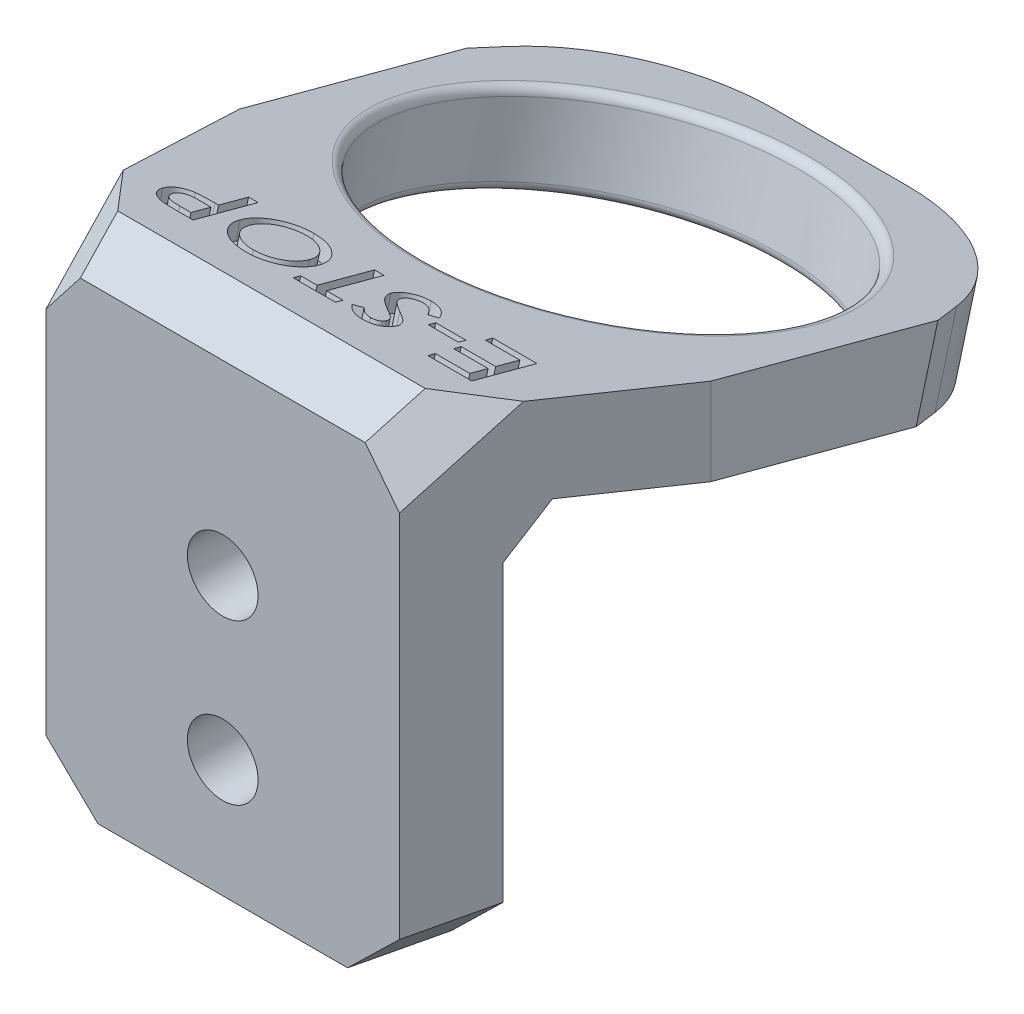
from build123d import *
from OCP.BRepFilletAPI import BRepFilletAPI_MakeChamfer

# Parameters (mm, degrees)
BOSS_EXTRUDE1_DEPTH   = 28
CUT_EXTRUDE1_DEPTH    = 50
SKETCH3_R             = 11.5
CUT_EXTRUDE2_DEPTH    = 5
CHAMFER1_SIZE         = 3
SKETCH4_R             = 2.1
CUT_EXTRUDE3_DEPTH    = 5
CHAMFER2_SIZE         = 3
CHAMFER2_SIZE2        = 2.449489743
FILLET1_R             = 0.5
CHAMFER3_SIZE         = 1
FILLET2_R             = 10
CHAMFER4_SIZE         = 2
CHAMFER4_SIZE2        = 2.272959563
CHAMFER4_EDGE_2_SIZE  = 2
CHAMFER4_EDGE_2_SIZE2 = 2.272959563
SKETCH5_W             = 1.794871795
SKETCH5_H             = 0.461538462
CUT_EXTRUDE4_DEPTH    = 1


with BuildPart() as part:
    # Sketch1 → Boss-Extrude1 (new body)
    with BuildSketch(Plane(origin=(0, 0, 0), x_dir=(0, 0, -1), z_dir=(1, 0, 0))):
        Polygon((0, 0), (0, -30), (5, -30), (5, -6.516126864), (35.411086173, -14.664752845), (36.705181399, -9.835123714), align=None)
    extrude(amount=BOSS_EXTRUDE1_DEPTH)

    # Sketch2 → Cut-Extrude1 (cut)
    with BuildSketch(Plane(origin=(0, 0, 0), x_dir=(1, 0, 0), z_dir=(0, 1, 0))):
        Polygon((3.5, 0), (0, 15), (0, 0), align=None)
        Polygon((28, 0), (24.5, 0), (28, 15), align=None)
    extrude(amount=-CUT_EXTRUDE1_DEPTH, mode=Mode.SUBTRACT)

    # Sketch3 → Cut-Extrude2 (cut)
    with BuildSketch(Plane(origin=(0, 0, 0), x_dir=(1, 0, 0), z_dir=(0, 0.9659258262890673, -0.2588190451025246))):
        with Locations(Location((14, 24, 0), (0, 0, 270))):
            Circle(SKETCH3_R)
        Polygon((3, 38), (0, 29.5), (0, 38), align=None)
        Polygon((28, 38), (25, 38), (28, 29.5), align=None)
    extrude(amount=-CUT_EXTRUDE2_DEPTH, mode=Mode.SUBTRACT)

    # Chamfer1
    chamfer1_edges = [part.edges().sort_by_distance(p)[0] for p in [
        (2.916666667, -30, -2.5),
        (25.083333333, -30, -2.5),
    ]]
    chamfer(chamfer1_edges, length=CHAMFER1_SIZE)

    # Sketch4 → Cut-Extrude3 (cut)
    with BuildSketch(Plane(origin=(0, 0, -5), x_dir=(-1, 0, 0), z_dir=(0, 0, -1))):
        with Locations((-14, -13.516126864)):
            Circle(SKETCH4_R)
        with Locations((-14, -23)):
            Circle(SKETCH4_R)
    extrude(amount=-CUT_EXTRUDE3_DEPTH, mode=Mode.SUBTRACT)

    # Chamfer2: one chamfer whose edges measure the first distance from different faces: ONE call of the kernel's chamfer builder (chamfer() names one face for all edges)
    chamfer2_edges_1 = [part.edges().sort_by_distance(p)[0] for p in [
        (14, -6.516126864, -5),
    ]]
    chamfer2_side_1 = [part.faces().sort_by_distance(p)[0] for p in [
        (14, -18.063791271, -5),
    ]]
    chamfer2_edges_2 = [part.edges().sort_by_distance(p)[0] for p in [
        (14, 0, 0),
    ]]
    chamfer2_side_2 = [part.faces().sort_by_distance(p)[0] for p in [
        (0.472016949, -5.827199858, -21.747405938),
    ]]
    chamfer2 = BRepFilletAPI_MakeChamfer(part.part.solid().wrapped)
    for e in chamfer2_edges_1:
        chamfer2.Add(CHAMFER2_SIZE, CHAMFER2_SIZE2, e.wrapped, chamfer2_side_1[0].wrapped)  # the first distance lies on this face
    for e in chamfer2_edges_2:
        chamfer2.Add(CHAMFER2_SIZE, CHAMFER2_SIZE2, e.wrapped, chamfer2_side_2[0].wrapped)  # the first distance lies on this face
    add(Compound.cast(chamfer2.Shape()), mode=Mode.REPLACE)

    # Fillet1
    fillet1_edges = [part.edges().sort_by_distance(p)[0] for p in [
        (14, -9.188076101, -34.290366833),
        (14, -14.017705233, -32.996271608),
    ]]
    fillet(fillet1_edges, radius=FILLET1_R)

    # Chamfer3
    chamfer3_edges = [part.edges().sort_by_distance(p)[0] for p in [
        (16.1, -13.516126864, -5),
        (16.1, -23, -5),
    ]]
    chamfer(chamfer3_edges, length=CHAMFER3_SIZE)

    # Fillet2
    fillet2_edges = [part.edges().sort_by_distance(p)[0] for p in [
        (3, -12.24993828, -36.058133786),
        (25, -12.24993828, -36.058133786),
    ]]
    fillet(fillet2_edges, radius=FILLET2_R)

    # Chamfer4
    chamfer4_edges = [part.edges().sort_by_distance(p)[0] for p in [
        (3.161925961, -1.612973439, -1.448888739),
    ]]
    chamfer4_side = [part.faces().sort_by_distance(p)[0] for p in [
        (14, -1.60427557, -1.463953891),
    ]]
    chamfer(chamfer4_edges, length=CHAMFER4_SIZE, length2=CHAMFER4_SIZE2, reference=chamfer4_side[0])

    # Chamfer4 edge 2
    chamfer4_edge_2_edges = [part.edges().sort_by_distance(p)[0] for p in [
        (24.838074039, -1.612973439, -1.448888739),
    ]]
    chamfer4_edge_2_side = [part.faces().sort_by_distance(p)[0] for p in [
        (14, -1.60427557, -1.463953891),
    ]]
    chamfer(chamfer4_edge_2_edges, length=CHAMFER4_EDGE_2_SIZE, length2=CHAMFER4_EDGE_2_SIZE2, reference=chamfer4_edge_2_side[0])

    # Sketch5 → Cut-Extrude4 (cut)
    # profile 1 of 6: a face of its own
    with BuildSketch(Plane(origin=(0, 0, 0), x_dir=(1, 0, 0), z_dir=(0, 0.9659258262890674, -0.25881904510252457))):
        Polygon((23.487179487, 5.5), (20.871794872, 5.5), (20.871794872, 5.961538462), (22.923076923, 5.961538462), (22.923076923, 7.08974359), (20.871794872, 7.08974359), (20.871794872, 7.551282051), (22.923076923, 7.551282051), (22.923076923, 9.038461538), (20.871794872, 9.038461538), (20.871794872, 9.5), (23.487179487, 9.5), align=None)
    # profile 2 of 6: a face of its own
    with BuildSketch(Plane(origin=(0, 0, 0), x_dir=(1, 0, 0), z_dir=(0, 0.9659258262890674, -0.25881904510252457))):
        with Locations((19.615384616, 7.987179487)):
            Rectangle(SKETCH5_W, SKETCH5_H)
    # profile 3 of 6: a face of its own
    with BuildSketch(Plane(origin=(0, 0, 0), x_dir=(1, 0, 0), z_dir=(0, 0.9659258262890674, -0.25881904510252457))):
        with BuildLine():
            Line((18.461538462, 8.705128205), (17.993589744, 8.474358974))
            add(Edge.make_bspline(
                [(17.993589744, 8.474358974), (17.959354756, 8.52696343), (17.893868775, 8.627587223), (17.787932117, 8.76387961), (17.680605445, 8.878915314), (17.572992906, 8.974378923), (17.463450752, 9.048388252), (17.352420295, 9.101600358), (17.239875611, 9.134741775), (17.163935855, 9.138954562), (17.126602564, 9.141025641)],
                knots=[0, 0, 0, 0, 1.321178742, 2.527200697, 3.629351455, 4.629811315, 5.550108467, 6.402922587, 7.214849271, 8, 8, 8, 8], degree=3))
            add(Edge.make_bspline(
                [(17.126602564, 9.141025641), (17.091801992, 9.140010464), (17.023119482, 9.138006908), (16.922203286, 9.120154133), (16.824274645, 9.093430583), (16.731660091, 9.053909615), (16.645598771, 9.006995366), (16.569840622, 8.950914233), (16.505046678, 8.887441807), (16.452615579, 8.816624426), (16.410099229, 8.742354056), (16.381922381, 8.66436365), (16.361643601, 8.585164993), (16.359865807, 8.531110984), (16.358974359, 8.50400641)],
                knots=[0, 0, 0, 0, 1.130239897, 2.230644695, 3.321798329, 4.423024733, 5.495612335, 6.500952383, 7.477041138, 8.432014547, 9.35704049, 10.247145551, 11.121057374, 12, 12, 12, 12], degree=3))
            add(Edge.make_bspline(
                [(16.358974359, 8.50400641), (16.360715559, 8.473102434), (16.364259999, 8.410193349), (16.392598463, 8.317022668), (16.436928998, 8.224337193), (16.478442062, 8.167392284), (16.5, 8.137820513)],
                knots=[0, 0, 0, 0, 0.927015872, 1.887062035, 2.90274091, 4, 4, 4, 4], degree=3))
            add(Edge.make_bspline(
                [(16.5, 8.137820513), (16.518430721, 8.115947052), (16.557557853, 8.069511223), (16.625290903, 8.001009514), (16.703598629, 7.929346722), (16.792829423, 7.854583029), (16.891544081, 7.775137952), (17.002527287, 7.693922238), (17.123679244, 7.608899909), (17.208494801, 7.551929499), (17.252403846, 7.522435897)],
                knots=[0, 0, 0, 0, 0.703636345, 1.493770772, 2.368296737, 3.315047346, 4.357938535, 5.485823767, 6.698410034, 8, 8, 8, 8], degree=3))
            add(Edge.make_bspline(
                [(17.252403846, 7.522435897), (17.297416598, 7.492729634), (17.383430985, 7.435964251), (17.503989818, 7.351690617), (17.612087399, 7.274482948), (17.707163875, 7.204055018), (17.788443784, 7.138493744), (17.857355665, 7.080582506), (17.913431238, 7.029034051), (17.943872685, 6.994612116), (17.957532051, 6.979166667)],
                knots=[0, 0, 0, 0, 1.450649473, 2.772030612, 3.956335671, 5.023968659, 5.954145879, 6.76460605, 7.445667014, 8, 8, 8, 8], degree=3))
            add(Edge.make_bspline(
                [(17.957532051, 6.979166667), (17.97708561, 6.955113536), (18.015428469, 6.907947402), (18.066598691, 6.833927926), (18.108632835, 6.7576007), (18.144757132, 6.680298199), (18.17175, 6.600974122), (18.191251676, 6.520269957), (18.202634426, 6.438092684), (18.204293837, 6.382779818), (18.205128205, 6.354967949)],
                knots=[0, 0, 0, 0, 1.083814774, 2.125268204, 3.141324264, 4.127667949, 5.105350172, 6.065883877, 7.027506829, 8, 8, 8, 8], degree=3))
            add(Edge.make_bspline(
                [(18.205128205, 6.354967949), (18.20357193, 6.311012212), (18.20050394, 6.22435932), (18.171960765, 6.098032581), (18.126799571, 5.977792319), (18.063367831, 5.864994024), (17.983529298, 5.761668723), (17.889835495, 5.667784932), (17.779487826, 5.588216305), (17.657654276, 5.519409371), (17.52558173, 5.465434983), (17.387012586, 5.425828189), (17.242533841, 5.402105305), (17.144318282, 5.399006234), (17.094551282, 5.397435897)],
                knots=[0, 0, 0, 0, 0.967311025, 1.906925137, 2.83817182, 3.78932571, 4.746287785, 5.707564954, 6.701000116, 7.73389989, 8.784156629, 9.836653355, 10.903806353, 12, 12, 12, 12], degree=3))
            add(Edge.make_bspline(
                [(17.094551282, 5.397435897), (17.038913536, 5.399243249), (16.928950697, 5.402815312), (16.766702004, 5.42785531), (16.610743709, 5.471182062), (16.48422873, 5.519137656), (16.386341921, 5.569651926), (16.311272228, 5.613696363), (16.236115505, 5.666122249), (16.160178859, 5.725879938), (16.081941008, 5.791374057), (16.003819161, 5.865438254), (15.924288269, 5.946294836), (15.872627971, 6.004054174), (15.846153846, 6.033653846)],
                knots=[0, 0, 0, 0, 1.380091053, 2.727621867, 4.060131507, 5.390217395, 6.074729597, 6.790622051, 7.547849161, 8.345727943, 9.187308138, 10.077929239, 11.015004885, 12, 12, 12, 12], degree=3))
            Line((15.846153846, 6.033653846), (16.297275641, 6.320512821))
            add(Edge.make_bspline(
                [(16.297275641, 6.320512821), (16.32034359, 6.297102195), (16.36476631, 6.252019571), (16.431830235, 6.189521382), (16.494713898, 6.132695561), (16.554042689, 6.082211698), (16.608974618, 6.037853719), (16.660857185, 6.000802223), (16.708642028, 5.969196317), (16.767995607, 5.936252668), (16.842256992, 5.905482299), (16.933320186, 5.87884968), (17.027714409, 5.86228568), (17.091814155, 5.86008579), (17.124198718, 5.858974359)],
                knots=[0, 0, 0, 0, 1.211298283, 2.332637626, 3.378344346, 4.335137, 5.203845459, 5.979793381, 6.684314862, 7.314473412, 8.479227738, 9.638184222, 10.80676015, 12, 12, 12, 12], degree=3))
            add(Edge.make_bspline(
                [(17.124198718, 5.858974359), (17.159862255, 5.860446073), (17.228796511, 5.863290757), (17.327282737, 5.887100741), (17.416664244, 5.925926377), (17.494857189, 5.980505785), (17.560977392, 6.047187323), (17.607354295, 6.127593112), (17.636881292, 6.217523196), (17.639617128, 6.281278757), (17.641025641, 6.314102564)],
                knots=[0, 0, 0, 0, 1.107639684, 2.140963101, 3.130056742, 4.120648403, 5.089736944, 6.024077683, 6.982719454, 8, 8, 8, 8], degree=3))
            add(Edge.make_bspline(
                [(17.641025641, 6.314102564), (17.640564499, 6.335528758), (17.63964713, 6.378152843), (17.627534178, 6.440645963), (17.61016699, 6.501924201), (17.583823128, 6.561273481), (17.550847992, 6.620882281), (17.507847056, 6.678837479), (17.456827388, 6.737441513), (17.417816605, 6.774111463), (17.397435897, 6.793269231)],
                knots=[0, 0, 0, 0, 0.925478106, 1.841094992, 2.74416004, 3.67567675, 4.643047564, 5.685347748, 6.790738184, 8, 8, 8, 8], degree=3))
            add(Edge.make_bspline(
                [(17.397435897, 6.793269231), (17.387074909, 6.801886044), (17.363240018, 6.821708556), (17.321012653, 6.853678277), (17.268368653, 6.893010769), (17.203896235, 6.938450386), (17.128828262, 6.991430154), (17.042225429, 7.050645725), (16.944355882, 7.116054071), (16.875780872, 7.162362753), (16.83974359, 7.186698718)],
                knots=[0, 0, 0, 0, 0.473655243, 1.089618189, 1.861401557, 2.783674801, 3.862059649, 5.091263366, 6.471411624, 8, 8, 8, 8], degree=3))
            add(Edge.make_bspline(
                [(16.83974359, 7.186698718), (16.791188213, 7.21897699), (16.697198395, 7.281458822), (16.564429991, 7.377013033), (16.442944391, 7.468911935), (16.333977543, 7.558580773), (16.236787722, 7.645303683), (16.150799682, 7.728048413), (16.077185507, 7.808401661), (16.015629777, 7.886855009), (15.963786586, 7.964109463), (15.919058991, 8.040199678), (15.879783129, 8.115384407), (15.849553666, 8.191325418), (15.825268975, 8.266798178), (15.807552379, 8.342034208), (15.796566903, 8.417141029), (15.79543518, 8.467111349), (15.794871795, 8.491987179)],
                knots=[0, 0, 0, 0, 1.607706065, 3.112075563, 4.510071815, 5.807725608, 7.00231083, 8.10134029, 9.097199534, 10.004822304, 10.848509488, 11.660746226, 12.438139144, 13.184922348, 13.911677748, 14.622737244, 15.31438191, 16, 16, 16, 16], degree=3))
            add(Edge.make_bspline(
                [(15.794871795, 8.491987179), (15.795786936, 8.527863744), (15.797602463, 8.599038343), (15.817143578, 8.703808407), (15.847012033, 8.805510179), (15.887491056, 8.904763278), (15.942507977, 8.999575654), (16.007407413, 9.092271012), (16.085019308, 9.181363985), (16.173335612, 9.266217583), (16.270023865, 9.344972145), (16.373607543, 9.414408895), (16.483728852, 9.472202398), (16.598852299, 9.520534565), (16.720017214, 9.557297755), (16.846502, 9.584034685), (16.978807172, 9.598990116), (17.068874776, 9.601360933), (17.114583333, 9.602564103)],
                knots=[0, 0, 0, 0, 0.900344094, 1.786169624, 2.667306864, 3.560748783, 4.471236799, 5.415060676, 6.39976209, 7.434252688, 8.488466066, 9.528750474, 10.561280777, 11.608015319, 12.660754287, 13.737217903, 14.851656958, 16, 16, 16, 16], degree=3))
            add(Edge.make_bspline(
                [(17.114583333, 9.602564103), (17.14798195, 9.60185639), (17.214093105, 9.600455503), (17.312221725, 9.592065769), (17.407479676, 9.575137831), (17.501054124, 9.555257471), (17.591689817, 9.526294849), (17.680650483, 9.493275696), (17.766780783, 9.452794599), (17.850550778, 9.405931587), (17.933489937, 9.352316765), (18.01312814, 9.287238185), (18.092885177, 9.21470914), (18.169923696, 9.131099039), (18.245757103, 9.038605419), (18.319425657, 8.935936294), (18.392680508, 8.824761981), (18.43817986, 8.745711427), (18.461538462, 8.705128205)],
                knots=[0, 0, 0, 0, 0.937330318, 1.855405837, 2.75979637, 3.650764605, 4.537371984, 5.426857402, 6.312038117, 7.204518178, 8.119160939, 9.078964442, 10.086785988, 11.142064281, 12.265810438, 13.441157596, 14.686333427, 16, 16, 16, 16], degree=3))
        make_face()
    # profile 4 of 6: a face of its own
    with BuildSketch(Plane(origin=(0, 0, 0), x_dir=(1, 0, 0), z_dir=(0, 0.9659258262890674, -0.25881904510252457))):
        Polygon((15.384615385, 5.961538462), (15.384615385, 5.5), (12.871794872, 5.5), (12.871794872, 5.961538462), (13.846153846, 5.961538462), (13.846153846, 9.5), (14.41025641, 9.5), (14.41025641, 5.961538462), align=None)
    # profile 5 of 6: a face of its own
    with BuildSketch(Plane(origin=(0, 0, 0), x_dir=(1, 0, 0), z_dir=(0, 0.9659258262890674, -0.25881904510252457))):
        with BuildLine():
            add(Edge.make_bspline(
                [(10.181891026, 5.397435897), (10.098203367, 5.399206638), (9.933787741, 5.402685496), (9.692526077, 5.432344831), (9.462031427, 5.479783687), (9.242364761, 5.547664575), (9.033638012, 5.634292895), (8.834980073, 5.739717607), (8.647744201, 5.8652996), (8.473608646, 6.008917482), (8.315028396, 6.165287102), (8.176238166, 6.331962219), (8.058423974, 6.506632385), (7.961456343, 6.68934114), (7.886498837, 6.880245915), (7.833674898, 7.079178513), (7.800424558, 7.286005208), (7.796739536, 7.426956655), (7.794871795, 7.498397436)],
                knots=[0, 0, 0, 0, 1.133465526, 2.226844992, 3.287846438, 4.317982888, 5.336769034, 6.345304697, 7.359975976, 8.385787809, 9.399070829, 10.372968382, 11.319399393, 12.24854394, 13.169826503, 14.091492747, 15.032679333, 16, 16, 16, 16], degree=3))
            add(Edge.make_bspline(
                [(7.794871795, 7.498397436), (7.796743589, 7.569306339), (7.800443349, 7.709463791), (7.833808382, 7.915446069), (7.886371437, 8.114208182), (7.961811287, 8.304587245), (8.056497581, 8.488200304), (8.174709215, 8.662417303), (8.313621281, 8.828894247), (8.471073884, 8.986337384), (8.64428189, 9.130219111), (8.829312012, 9.256748003), (9.0243326, 9.363955493), (9.229509189, 9.451931028), (9.445145523, 9.518603086), (9.66989512, 9.568040011), (9.904944485, 9.597220212), (10.065089431, 9.600761097), (10.146634615, 9.602564103)],
                knots=[0, 0, 0, 0, 0.968886053, 1.915085334, 2.845193648, 3.774914766, 4.709178866, 5.66427878, 6.647096819, 7.669648038, 8.704366239, 9.721300744, 10.729701935, 11.742411692, 12.768036067, 13.810950831, 14.885344663, 16, 16, 16, 16], degree=3))
            add(Edge.make_bspline(
                [(10.146634615, 9.602564103), (10.226304707, 9.600683989), (10.382944749, 9.596987483), (10.613209289, 9.56880663), (10.833716895, 9.520220562), (11.045243929, 9.454279452), (11.246616684, 9.36744692), (11.439379979, 9.263376563), (11.621496418, 9.138152241), (11.792592513, 8.996556484), (11.948612269, 8.841670233), (12.08582957, 8.676871054), (12.201978044, 8.503747418), (12.297483014, 8.322668274), (12.370591171, 8.132606545), (12.423666176, 7.9350513), (12.455771388, 7.728880954), (12.459595795, 7.588789721), (12.461538462, 7.517628205)],
                knots=[0, 0, 0, 0, 1.102743233, 2.168112804, 3.205229065, 4.224943949, 5.230421689, 6.2363888, 7.252719487, 8.284768024, 9.307047138, 10.291751769, 11.248543191, 12.187944297, 13.119724947, 14.061473478, 15.01529537, 16, 16, 16, 16], degree=3))
            add(Edge.make_bspline(
                [(12.461538462, 7.517628205), (12.460628363, 7.469782882), (12.458824311, 7.374941015), (12.443955834, 7.234081161), (12.419665418, 7.096065117), (12.387340398, 6.960277882), (12.343553852, 6.827615479), (12.290324005, 6.697748669), (12.22897946, 6.569786734), (12.156658693, 6.446276412), (12.076793742, 6.327278786), (11.99013519, 6.213800288), (11.896402568, 6.107266779), (11.79541032, 6.007233754), (11.687871831, 5.913615336), (11.572122858, 5.827757545), (11.450743456, 5.747418233), (11.322443994, 5.675054643), (11.190204954, 5.608983683), (11.05349211, 5.553419367), (10.914853232, 5.504917695), (10.773271521, 5.465577805), (10.629011943, 5.435063682), (10.482045523, 5.413889449), (10.332827607, 5.399261544), (10.23240725, 5.398046914), (10.181891026, 5.397435897)],
                knots=[0, 0, 0, 0, 0.994755869, 1.971864723, 2.941605403, 3.907489226, 4.871758807, 5.843342801, 6.824563096, 7.820062962, 8.81673969, 9.80321201, 10.787069662, 11.764999032, 12.757224245, 13.749200702, 14.759755514, 15.782101152, 16.810449002, 17.831571837, 18.848592879, 19.863306026, 20.885093281, 21.912510758, 22.949893459, 24, 24, 24, 24], degree=3))
        make_face()
        with BuildLine():
            add(Edge.make_bspline(
                [(10.162660256, 5.858974359), (10.199812877, 5.859509448), (10.273732815, 5.860574078), (10.383946939, 5.871651513), (10.49283906, 5.888336757), (10.600556946, 5.911382287), (10.706610453, 5.94229624), (10.811534937, 5.979039899), (10.915456955, 6.022445621), (11.017190996, 6.072857388), (11.116424398, 6.128228079), (11.209809267, 6.190347992), (11.299119574, 6.256054839), (11.381690767, 6.328329754), (11.460269362, 6.404459628), (11.532171883, 6.486704447), (11.599654432, 6.573149949), (11.661637717, 6.664488701), (11.716140719, 6.76054074), (11.766084711, 6.858803674), (11.805413161, 6.961520225), (11.83988363, 7.06634628), (11.864654876, 7.17486598), (11.884880707, 7.285674001), (11.894668933, 7.399930871), (11.896506168, 7.477016584), (11.897435897, 7.516025641)],
                knots=[0, 0, 0, 0, 1.001990644, 1.993589858, 2.985162891, 3.973063808, 4.962828715, 5.963263633, 6.970938057, 7.998914906, 9.024945377, 10.03419009, 11.022800262, 12.013823346, 12.992138789, 13.972309967, 14.958185389, 15.949444203, 16.946864503, 17.936157182, 18.91963346, 19.910892273, 20.910600357, 21.919896513, 22.947368164, 24, 24, 24, 24], degree=3))
            add(Edge.make_bspline(
                [(11.897435897, 7.516025641), (11.895967007, 7.573272829), (11.89308435, 7.685618917), (11.868283048, 7.850236488), (11.828390794, 8.007446957), (11.771857625, 8.157346891), (11.699697019, 8.300200145), (11.609609296, 8.434339715), (11.504896236, 8.561760292), (11.385373113, 8.680038398), (11.254614512, 8.78726847), (11.116997394, 8.882474553), (10.972454291, 8.96177695), (10.822795537, 9.028629403), (10.665966921, 9.078677859), (10.503459285, 9.114731993), (10.335021695, 9.137049235), (10.220688488, 9.13968692), (10.162660256, 9.141025641)],
                knots=[0, 0, 0, 0, 1.037379764, 2.035830297, 3.010622093, 3.972958488, 4.934478295, 5.905474182, 6.896239315, 7.920024812, 8.948608687, 9.958640176, 10.949144946, 11.933451802, 12.925754051, 13.927873108, 14.948320782, 16, 16, 16, 16], degree=3))
            add(Edge.make_bspline(
                [(10.162660256, 9.141025641), (10.121769456, 9.14049908), (10.040653107, 9.139454526), (9.920310996, 9.128374277), (9.802213195, 9.112027042), (9.686488424, 9.087511555), (9.572960486, 9.057381396), (9.461624869, 9.020224629), (9.352798891, 8.976437384), (9.247359068, 8.925007042), (9.146132842, 8.868294461), (9.04936126, 8.807457366), (8.958534752, 8.741134891), (8.874719538, 8.668214585), (8.794577408, 8.592607703), (8.7218669, 8.510296545), (8.65430891, 8.42365999), (8.592749828, 8.332369938), (8.537366086, 8.237567474), (8.490399714, 8.139126412), (8.448740301, 8.038939787), (8.416428656, 7.935515952), (8.390445581, 7.829852861), (8.371863723, 7.721439831), (8.36170546, 7.610237634), (8.359887925, 7.535275244), (8.358974359, 7.497596154)],
                knots=[0, 0, 0, 0, 1.081858578, 2.146116458, 3.195743449, 4.235470108, 5.274523773, 6.302749639, 7.339709431, 8.37664513, 9.405113932, 10.409147488, 11.400208425, 12.377741397, 13.347602899, 14.313825616, 15.280952855, 16.253361111, 17.22569229, 18.183605493, 19.137886711, 20.094677823, 21.047885093, 22.015890201, 23.002707179, 24, 24, 24, 24], degree=3))
            add(Edge.make_bspline(
                [(8.358974359, 7.497596154), (8.35988429, 7.460184421), (8.361688083, 7.386021614), (8.371823563, 7.276138445), (8.390680129, 7.168857281), (8.416160053, 7.064137772), (8.448748901, 6.961832039), (8.490611863, 6.863094527), (8.537152885, 6.765766997), (8.59279678, 6.672427844), (8.654522855, 6.582408712), (8.72263107, 6.496816721), (8.796487626, 6.415677751), (8.876337645, 6.339209087), (8.96205026, 6.26693645), (9.054367276, 6.199804523), (9.152319079, 6.137226009), (9.255548193, 6.079592753), (9.362648008, 6.028107959), (9.472346722, 5.982909207), (9.583345826, 5.944548065), (9.696196403, 5.912883117), (9.810615209, 5.889299209), (9.926620968, 5.871292899), (10.044136339, 5.860679246), (10.123109512, 5.85954327), (10.162660256, 5.858974359)],
                knots=[0, 0, 0, 0, 0.993994102, 1.970435157, 2.928134796, 3.884966656, 4.831881522, 5.77666729, 6.731840291, 7.695618628, 8.659997506, 9.62960877, 10.598986353, 11.572535772, 12.564603331, 13.575073874, 14.602516262, 15.650745094, 16.713876989, 17.757460749, 18.800875647, 19.832059759, 20.868794719, 21.902392729, 22.949492276, 24, 24, 24, 24], degree=3))
        make_face(mode=Mode.SUBTRACT)
    # profile 6 of 6: a face of its own
    with BuildSketch(Plane(origin=(0, 0, 0), x_dir=(1, 0, 0), z_dir=(0, 0.9659258262890674, -0.25881904510252457))):
        with BuildLine():
            Line((6.923076923, 5.5), (6.021634615, 5.5))
            add(Edge.make_bspline(
                [(6.021634615, 5.5), (5.96180189, 5.500013131), (5.847468717, 5.500038223), (5.683493164, 5.504065556), (5.534895673, 5.506791338), (5.401412467, 5.514972502), (5.282951887, 5.522025731), (5.179588101, 5.532697989), (5.091246345, 5.543961686), (5.037885293, 5.5545021), (5.013621795, 5.559294872)],
                knots=[0, 0, 0, 0, 1.420054941, 2.713554957, 3.893121933, 4.947019132, 5.887399642, 6.709333097, 7.41312824, 8, 8, 8, 8], degree=3))
            add(Edge.make_bspline(
                [(5.013621795, 5.559294872), (4.979828414, 5.567348138), (4.913235061, 5.583217931), (4.817185556, 5.615183994), (4.725417738, 5.650176805), (4.640284518, 5.693951716), (4.558837402, 5.740109766), (4.484405419, 5.794775534), (4.41419383, 5.85328908), (4.349357481, 5.916919877), (4.291675628, 5.986076642), (4.241005775, 6.058885258), (4.198265522, 6.135735521), (4.162886367, 6.215860903), (4.135422752, 6.299857854), (4.116261581, 6.387634615), (4.105009764, 6.479140253), (4.103386869, 6.541368534), (4.102564103, 6.572916667)],
                knots=[0, 0, 0, 0, 1.123641893, 2.214252562, 3.273589201, 4.297932292, 5.3089514, 6.299667451, 7.281292782, 8.265312556, 9.234761387, 10.191410371, 11.13167555, 12.075984217, 13.021715869, 13.986413702, 14.979163693, 16, 16, 16, 16], degree=3))
            add(Edge.make_bspline(
                [(4.102564103, 6.572916667), (4.10338584, 6.604729771), (4.105000003, 6.667221182), (4.116167984, 6.759029615), (4.135799699, 6.846838819), (4.161651343, 6.931156226), (4.196892488, 7.011039255), (4.238581869, 7.087705044), (4.288189382, 7.160492596), (4.345642061, 7.228896466), (4.409513638, 7.292955503), (4.480396384, 7.351613945), (4.557968647, 7.40486235), (4.64218705, 7.452370735), (4.732137445, 7.496540485), (4.829450962, 7.532411788), (4.932528319, 7.565183775), (5.004141511, 7.58194802), (5.040865385, 7.590544872)],
                knots=[0, 0, 0, 0, 1.010064267, 1.984098792, 2.930610002, 3.863999294, 4.779338348, 5.697775668, 6.631588642, 7.570815514, 8.530269198, 9.499900574, 10.487864199, 11.513438116, 12.567882734, 13.665667411, 14.802933727, 16, 16, 16, 16], degree=3))
            add(Edge.make_bspline(
                [(5.040865385, 7.590544872), (5.068057511, 7.595929909), (5.127757237, 7.607752642), (5.226302427, 7.61971358), (5.341231141, 7.629913811), (5.4721555, 7.638453883), (5.619594109, 7.645890376), (5.783368297, 7.650141072), (5.963659764, 7.653694011), (6.08920719, 7.653794023), (6.154647436, 7.653846154)],
                knots=[0, 0, 0, 0, 0.595394016, 1.307174701, 2.131162377, 3.074388912, 4.125801372, 5.302695092, 6.594058824, 8, 8, 8, 8], degree=3))
            Line((6.154647436, 7.653846154), (6.358974359, 7.653846154))
            Line((6.358974359, 7.653846154), (6.358974359, 9.5))
            Line((6.358974359, 9.5), (6.923076923, 9.5))
            Line((6.923076923, 9.5), (6.923076923, 5.5))
        make_face()
        with BuildLine():
            Line((6.358974359, 5.961538462), (6.358974359, 7.193910256))
            Line((6.358974359, 7.193910256), (5.720352564, 7.200320513))
            add(Edge.make_bspline(
                [(5.720352564, 7.200320513), (5.684827844, 7.199892855), (5.616435785, 7.19906953), (5.517559606, 7.196166156), (5.426476936, 7.190361395), (5.342783742, 7.183489711), (5.266833223, 7.17402551), (5.198333415, 7.162140714), (5.137621408, 7.14783349), (5.067741051, 7.126894721), (4.989664284, 7.094217767), (4.906642965, 7.043445437), (4.834030399, 6.982801851), (4.77393184, 6.91214332), (4.726898115, 6.834147013), (4.691368653, 6.751631973), (4.671144283, 6.663887772), (4.668170268, 6.603997336), (4.666666667, 6.573717949)],
                knots=[0, 0, 0, 0, 1.229532601, 2.367091648, 3.422842283, 4.387765565, 5.272881778, 6.070724791, 6.792669982, 7.430140688, 8.594132226, 9.710194126, 10.786027086, 11.854808201, 12.904267907, 13.927467896, 14.952169891, 16, 16, 16, 16], degree=3))
            add(Edge.make_bspline(
                [(4.666666667, 6.573717949), (4.668179345, 6.544236708), (4.671184699, 6.485664045), (4.691530676, 6.39956208), (4.726883751, 6.318064727), (4.773940215, 6.241051589), (4.83315965, 6.171626025), (4.902596187, 6.111347543), (4.98254485, 6.06363971), (5.055734872, 6.030390771), (5.122191723, 6.011006582), (5.180146567, 5.997193483), (5.245759821, 5.98630565), (5.319056653, 5.977728703), (5.400025704, 5.970619053), (5.488980157, 5.964929306), (5.585714179, 5.961797526), (5.652775627, 5.961626842), (5.6875, 5.961538462)],
                knots=[0, 0, 0, 0, 1.050038207, 2.086192147, 3.130568797, 4.202616696, 5.289256656, 6.368667174, 7.461909375, 8.595035624, 9.221083545, 9.92492745, 10.716365047, 11.58844232, 12.553164869, 13.611317899, 14.763142033, 16, 16, 16, 16], degree=3))
            Line((5.6875, 5.961538462), (6.358974359, 5.961538462))
        make_face(mode=Mode.SUBTRACT)
    extrude(amount=-CUT_EXTRUDE4_DEPTH, mode=Mode.SUBTRACT)


solid = part.part
